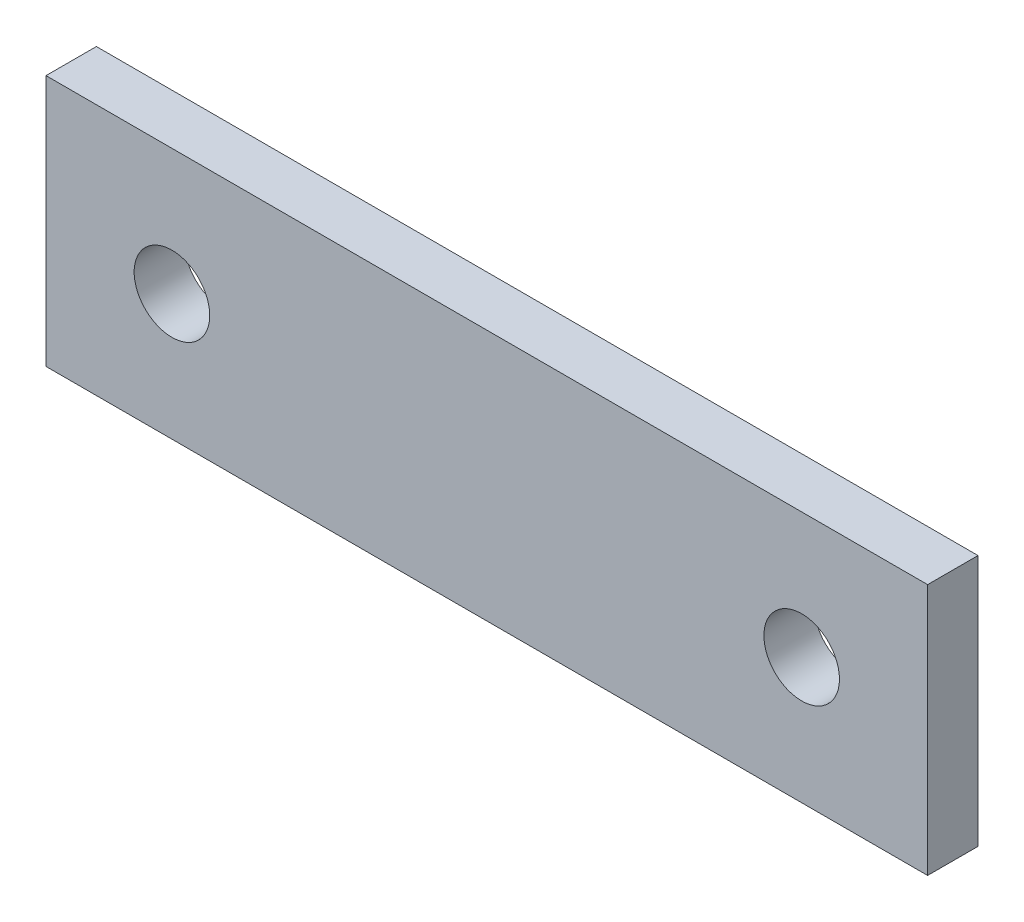
from build123d import *

# Parameters (mm, degrees)
SKETCH_1_W      = 35
SKETCH_1_H      = 10
SKETCH_1_R      = 1.5
EXTRUDE_1_DEPTH = 2


with BuildPart() as part:
    # 草图1 → 凸台-拉伸1 (new body)
    with BuildSketch(Plane.XY):
        with Locations((17.5, 5)):
            Rectangle(SKETCH_1_W, SKETCH_1_H)
        with Locations((5, 5)):
            Circle(SKETCH_1_R, mode=Mode.SUBTRACT)
        with Locations((30, 5)):
            Circle(SKETCH_1_R, mode=Mode.SUBTRACT)
    extrude(amount=EXTRUDE_1_DEPTH)


solid = part.part
